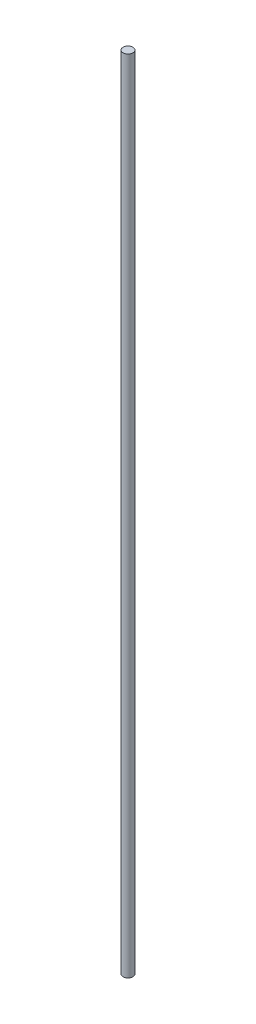
from build123d import *

# Parameters (mm, degrees)
SKETCH1_R           = 11.25
BOSS_EXTRUDE1_DEPTH = 1828.8


with BuildPart() as part:
    # Sketch1 → Boss-Extrude1 (new body)
    with BuildSketch(Plane(origin=(0, 0, 0), x_dir=(1, 0, 0), z_dir=(0, 1, 0))):
        with Locations(Location((0, 0, 0), (0, 0, 270))):
            Circle(SKETCH1_R)
    extrude(amount=BOSS_EXTRUDE1_DEPTH)


solid = part.part
